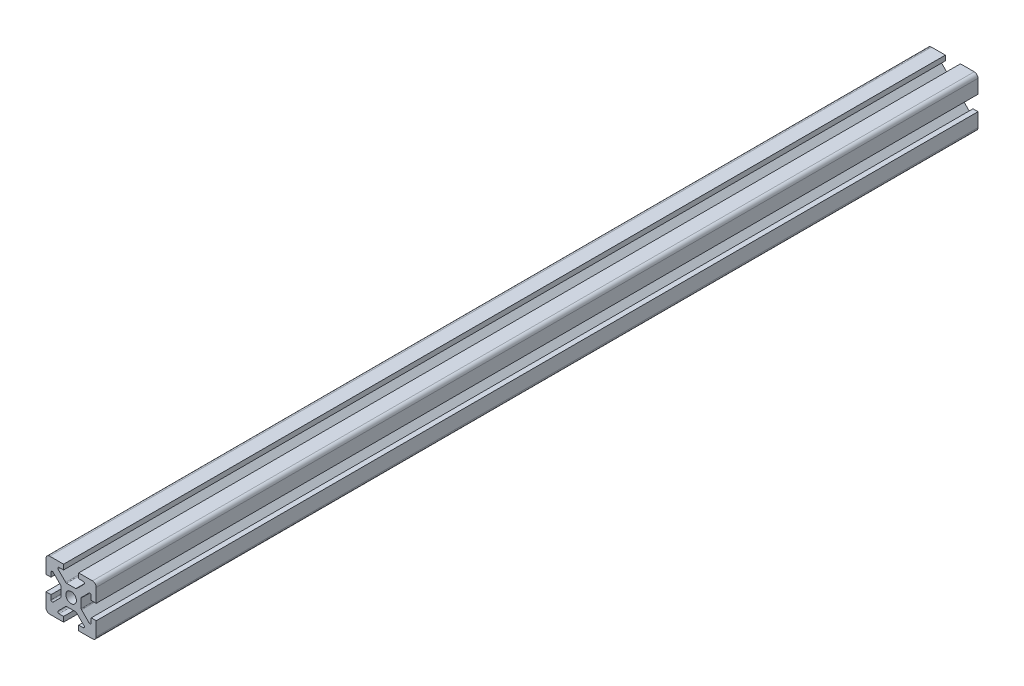
from build123d import *

# Parameters (mm, degrees)
SKETCH_2_W               = 20
SKETCH_2_H               = 20
EXTRUDE_1_DEPTH          = 351
FILLET_1_R               = 1.5
CUT_EXTRUDE_1_DEPTH      = 352.284784754
CUT_EXTRUDE_1_DEPTH_BACK = 352.284784754
SKETCH_3_R               = 2.1


with BuildPart() as part:
    # 草圖2 → 填料-伸長1 (new body)
    with BuildSketch(Plane.XY):
        Rectangle(SKETCH_2_W, SKETCH_2_H)
    extrude(amount=EXTRUDE_1_DEPTH)

    # 圓角1
    fillet_1_edges = [part.edges().sort_by_distance(p)[0] for p in [
        (-10, 10, 175.5),
        (10, 10, 175.5),
        (10, -10, 175.5),
        (-10, -10, 175.5),
    ]]
    fillet(fillet_1_edges, radius=FILLET_1_R)

    # 草圖3 → 除料-伸長1 (cut, two sides: drawn at the far end of the back side and taken through both)
    with BuildSketch(Plane.XY.offset(351).offset(-CUT_EXTRUDE_1_DEPTH_BACK)):
        Circle(SKETCH_3_R)
        with BuildLine():
            Line((10, 3), (8, 3))
            Line((8, 3), (8, 4.792893219))
            ThreePointArc((8, 4.792893219), (7.691341716, 5.254832985), (7.146446609, 5.146446609))
            Line((7.146446609, 5.146446609), (4.146446609, 2.146446609))
            ThreePointArc((4.146446609, 2.146446609), (4.038060234, 1.984234935), (4, 1.792893219))
            Line((4, 1.792893219), (4, -1.792893219))
            ThreePointArc((4, -1.792893219), (4.038060234, -1.984234935), (4.146446609, -2.146446609))
            Line((4.146446609, -2.146446609), (7.146446609, -5.146446609))
            ThreePointArc((7.146446609, -5.146446609), (7.691341716, -5.254832985), (8, -4.792893219))
            Line((8, -4.792893219), (8, -3))
            Line((8, -3), (10, -3))
            Line((10, -3), (10, 3))
        make_face()
        with BuildLine():
            Line((-3, -10), (3, -10))
            Line((3, -10), (3, -8))
            Line((3, -8), (4.792893219, -8))
            ThreePointArc((4.792893219, -8), (5.254832985, -7.691341716), (5.146446609, -7.146446609))
            Line((5.146446609, -7.146446609), (2.146446609, -4.146446609))
            ThreePointArc((2.146446609, -4.146446609), (1.984234935, -4.038060234), (1.792893219, -4))
            Line((1.792893219, -4), (-1.792893219, -4))
            ThreePointArc((-1.792893219, -4), (-1.984234935, -4.038060234), (-2.146446609, -4.146446609))
            Line((-2.146446609, -4.146446609), (-5.146446609, -7.146446609))
            ThreePointArc((-5.146446609, -7.146446609), (-5.254832985, -7.691341716), (-4.792893219, -8))
            Line((-4.792893219, -8), (-3, -8))
            Line((-3, -8), (-3, -10))
        make_face()
        with BuildLine():
            Line((-10, 3), (-10, -3))
            Line((-10, -3), (-8, -3))
            Line((-8, -3), (-8, -4.792893219))
            ThreePointArc((-8, -4.792893219), (-7.691341716, -5.254832985), (-7.146446609, -5.146446609))
            Line((-7.146446609, -5.146446609), (-4.146446609, -2.146446609))
            ThreePointArc((-4.146446609, -2.146446609), (-4.038060234, -1.984234935), (-4, -1.792893219))
            Line((-4, -1.792893219), (-4, 1.792893219))
            ThreePointArc((-4, 1.792893219), (-4.038060234, 1.984234935), (-4.146446609, 2.146446609))
            Line((-4.146446609, 2.146446609), (-7.146446609, 5.146446609))
            ThreePointArc((-7.146446609, 5.146446609), (-7.691341716, 5.254832985), (-8, 4.792893219))
            Line((-8, 4.792893219), (-8, 3))
            Line((-8, 3), (-10, 3))
        make_face()
        with BuildLine():
            Line((3, 10), (-3, 10))
            Line((-3, 10), (-3, 8))
            Line((-3, 8), (-4.792893219, 8))
            ThreePointArc((-4.792893219, 8), (-5.254832985, 7.691341716), (-5.146446609, 7.146446609))
            Line((-5.146446609, 7.146446609), (-2.146446609, 4.146446609))
            ThreePointArc((-2.146446609, 4.146446609), (-1.984234935, 4.038060234), (-1.792893219, 4))
            Line((-1.792893219, 4), (1.792893219, 4))
            ThreePointArc((1.792893219, 4), (1.984234935, 4.038060234), (2.146446609, 4.146446609))
            Line((2.146446609, 4.146446609), (5.146446609, 7.146446609))
            ThreePointArc((5.146446609, 7.146446609), (5.254832985, 7.691341716), (4.792893219, 8))
            Line((4.792893219, 8), (3, 8))
            Line((3, 8), (3, 10))
        make_face()
    extrude(amount=CUT_EXTRUDE_1_DEPTH + CUT_EXTRUDE_1_DEPTH_BACK, mode=Mode.SUBTRACT)


solid = part.part
